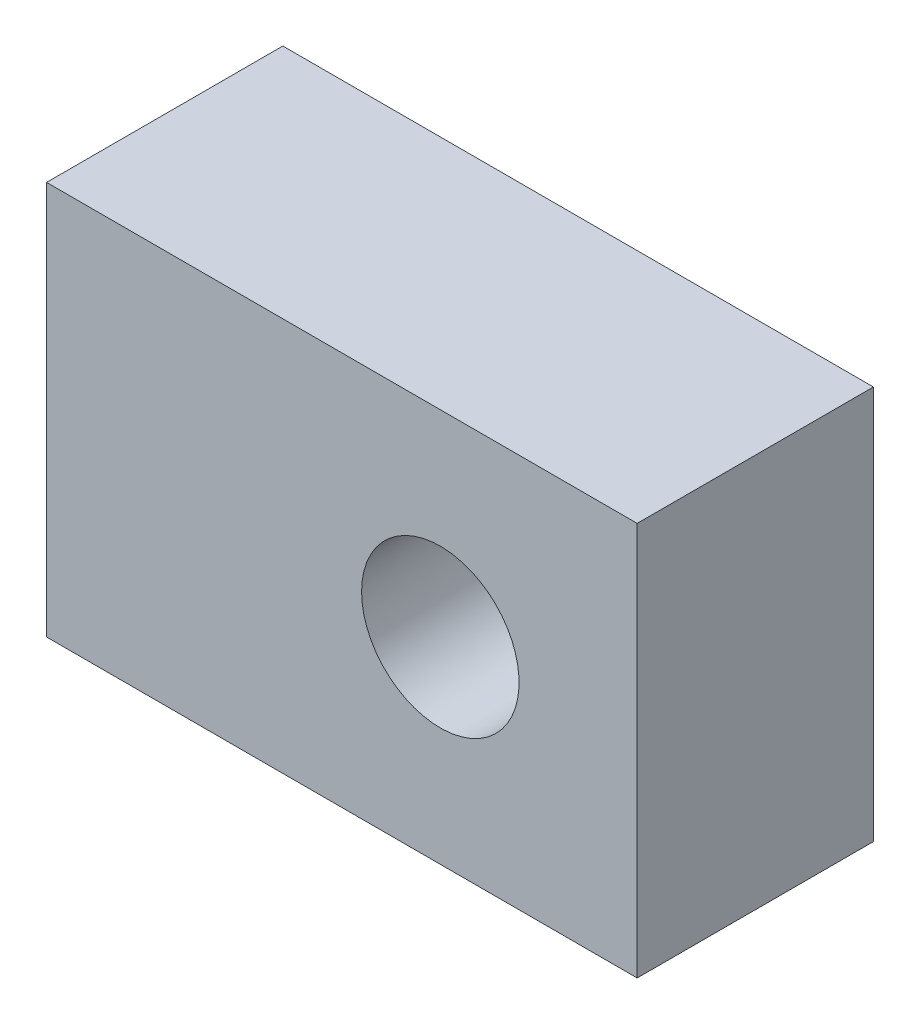
from build123d import *

# Parameters (mm, degrees)
SKETCH1_W           = 15
SKETCH1_H           = 10
BOSS_EXTRUDE1_DEPTH = 6
SKETCH2_R           = 2
CUT_EXTRUDE1_DEPTH  = 6


with BuildPart() as part:
    # Sketch1 → Boss-Extrude1 (new body)
    with BuildSketch(Plane.XY):
        with Locations((7.5, 5)):
            Rectangle(SKETCH1_W, SKETCH1_H)
    extrude(amount=BOSS_EXTRUDE1_DEPTH)

    # Sketch2 → Cut-Extrude1 (cut)
    with BuildSketch(Plane(origin=(0, 0, 0), x_dir=(-1, 0, 0), z_dir=(0, 0, -1))):
        with Locations((-10, 5)):
            Circle(SKETCH2_R)
    extrude(amount=-CUT_EXTRUDE1_DEPTH, mode=Mode.SUBTRACT)


solid = part.part
